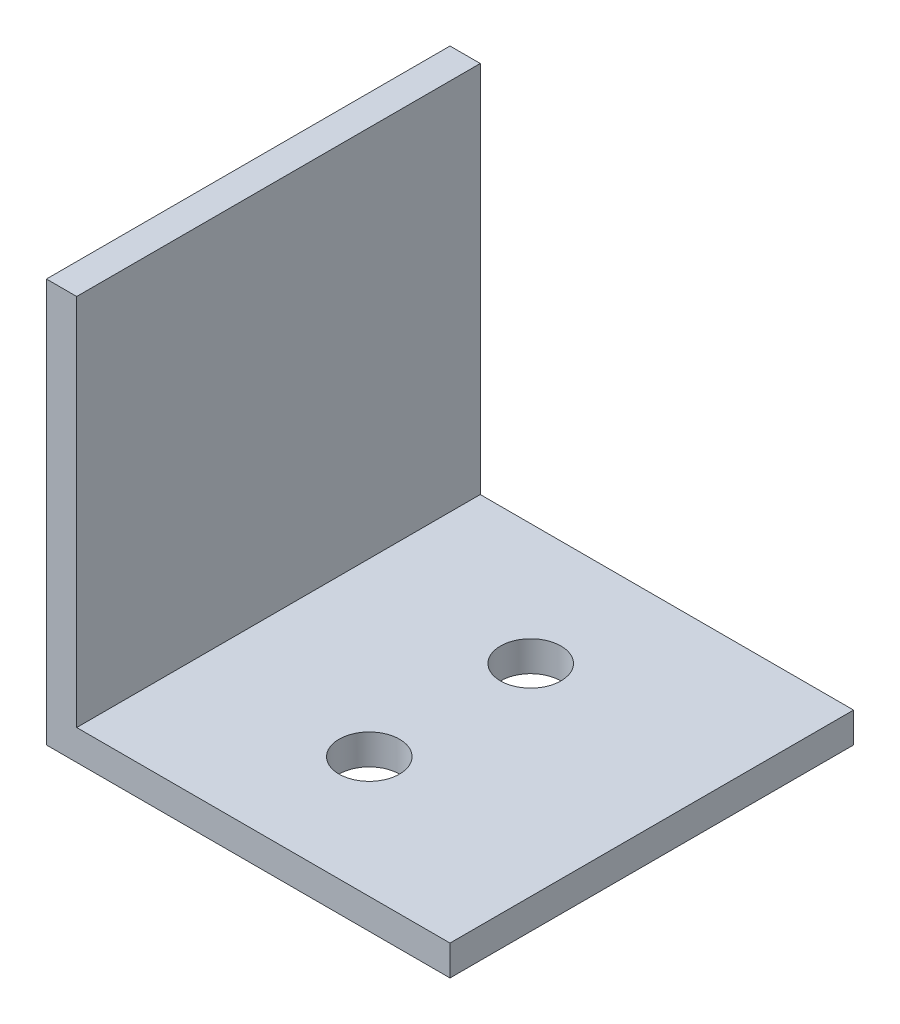
from build123d import *

# Parameters (mm, degrees)
EXTRUSION1_DEPTH = 20
ESQUISSE2_R      = 1.5
EXTRUSION2_DEPTH = 20


with BuildPart() as part:
    # Esquisse1 → Extrusion1 (new body)
    with BuildSketch(Plane.XY):
        Polygon((-18.714271359, 3.498089172), (-18.714271359, -16.501910828), (1.285728641, -16.501910828), (1.285728641, -15.001910828), (-17.214271359, -15.001910828), (-17.214271359, 3.498089172), align=None)
    extrude(amount=EXTRUSION1_DEPTH)

    # Esquisse2 → Extrusion2 (cut)
    with BuildSketch(Plane(origin=(0, -15.001910828, 0), x_dir=(-1, 0, 0), z_dir=(0, 1, 0))):
        with Locations((8.714271359, 14)):
            Circle(ESQUISSE2_R)
        with Locations((8.714271359, 6)):
            Circle(ESQUISSE2_R)
    extrude(amount=-EXTRUSION2_DEPTH, mode=Mode.SUBTRACT)


solid = part.part
